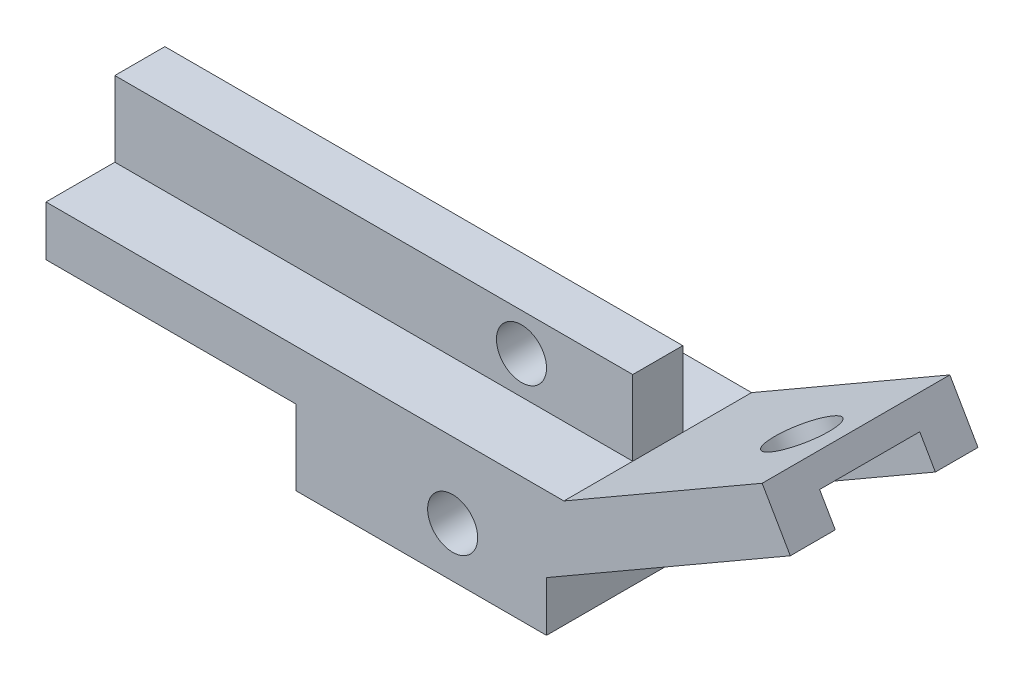
from build123d import *

# Parameters (mm, degrees)
SKETCH_1_R           = 4
EXTRUDE_4_DEPTH      = 15
SKETCH_1_15_W        = 82.784609691
SKETCH_1_15_H        = 12
SKETCH_1_15_R        = 4
EXTRUDE_5_DEPTH      = 4
SKETCH_15_R          = 5
CUT_EXTRUDE_9_DEPTH  = 118.165082722
SKETCH_16_W          = 16
SKETCH_16_H          = 5
CUT_EXTRUDE_10_DEPTH = 30


with BuildPart() as part:
    # 스케치1 → 보스-돌출4 (new, symmetric)
    with BuildSketch(Plane.XY):
        Polygon((0, 8), (0, 0), (40, 0), (40, -12), (80, -12), (80, -4), (118.97114317, 18.5), (114.47114317, 26.294228634), (82.784609691, 8), align=None)
        with Locations((65, -4)):
            Circle(SKETCH_1_R, mode=Mode.SUBTRACT)
    extrude(amount=EXTRUDE_4_DEPTH, both=True)

    # 스케치1<15> → 보스-돌출5 (add, symmetric)
    with BuildSketch(Plane.XY):
        with Locations((41.392304845, 14)):
            Rectangle(SKETCH_1_15_W, SKETCH_1_15_H)
        with Locations((65, 14)):
            Circle(SKETCH_1_15_R, mode=Mode.SUBTRACT)
    extrude(amount=EXTRUDE_5_DEPTH, both=True)

    # 스케치15 → 컷-돌출9 (cut, through all)
    with BuildSketch(Plane(origin=(17.232050808, -29.846787517, 0), x_dir=(0.8660254037844362, 0.5000000000000044, 0), z_dir=(-0.5000000000000044, 0.8660254037844362, 0))):
        with Locations((102.282032303, 0)):
            Circle(SKETCH_15_R)
    extrude(amount=-CUT_EXTRUDE_9_DEPTH, mode=Mode.SUBTRACT)

    # 스케치16 → 컷-돌출10 (cut)
    with BuildSketch(Plane(origin=(97.239092363, 56.141016151, 0), x_dir=(0, 0, -1), z_dir=(0.8660254037844364, 0.5000000000000041, 0))):
        with Locations((0.188244246, -40.964101615)):
            Rectangle(SKETCH_16_W, SKETCH_16_H)
    extrude(amount=-CUT_EXTRUDE_10_DEPTH, mode=Mode.SUBTRACT)


solid = part.part
